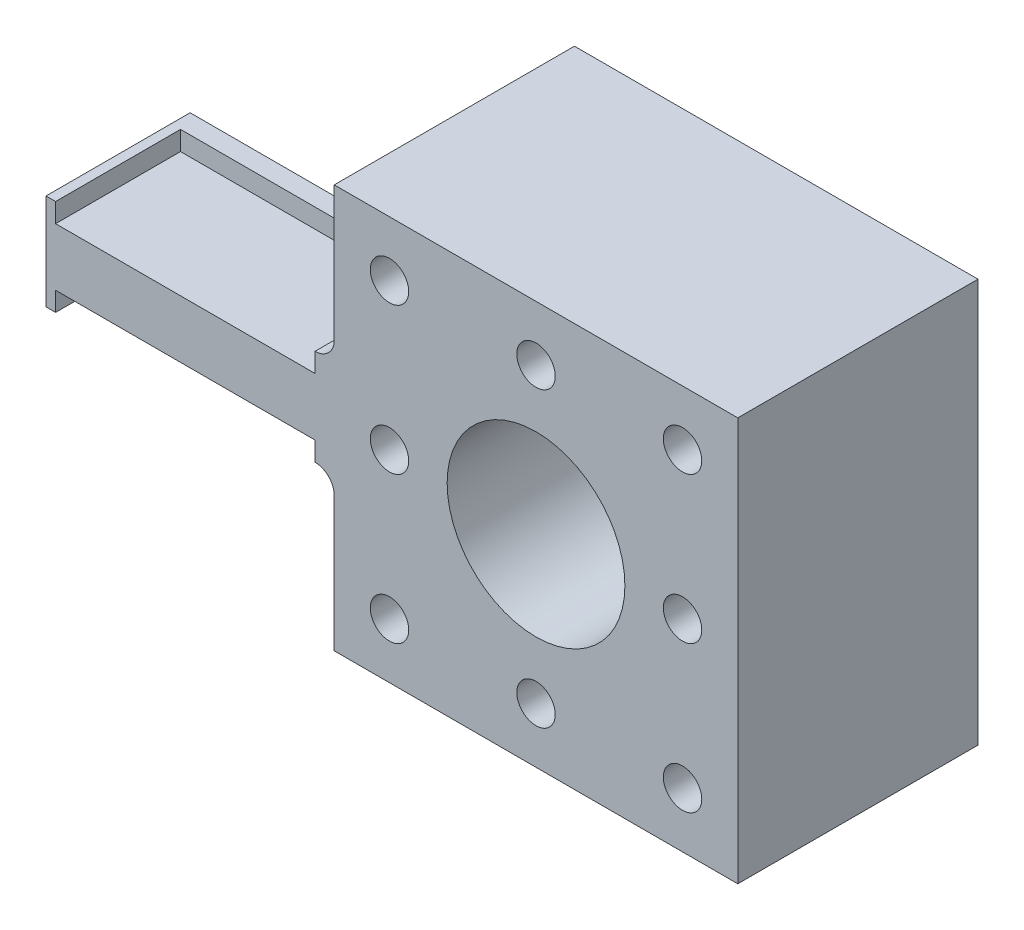
from build123d import *

# Parameters (mm, degrees)
SKETCH_1_W          = 42
SKETCH_1_H          = 42
EXTRUDE_1_DEPTH     = 25
SKETCH_2_R          = 9.25
CUT_EXTRUDE_1_DEPTH = 65.443773943
SKETCH_3_R          = 2
CUT_EXTRUDE_2_DEPTH = 3
EXTRUDE_2_DEPTH     = 30
SKETCH_5_W          = 27
SKETCH_5_H          = 13
CUT_EXTRUDE_3_DEPTH = 2
SKETCH_6_W          = 27
SKETCH_6_H          = 13
CUT_EXTRUDE_4_DEPTH = 2
FILLET_1_R          = 2


with BuildPart() as part:
    # 스케치1 → 보스-돌출1 (new body)
    with BuildSketch(Plane.XY):
        with Locations((21, -21)):
            Rectangle(SKETCH_1_W, SKETCH_1_H)
    extrude(amount=EXTRUDE_1_DEPTH)

    # 스케치2 → 컷-돌출1 (cut, through all)
    with BuildSketch(Plane.XY.offset(25)):
        with Locations((21, -21)):
            Circle(SKETCH_2_R)
    extrude(amount=-CUT_EXTRUDE_1_DEPTH, mode=Mode.SUBTRACT)

    # 스케치3 → 컷-돌출2 (cut)
    with BuildSketch(Plane.XY.offset(25)):
        with Locations((36.25, -36.25)):
            Circle(SKETCH_3_R)
        with Locations((5.75, -36.25)):
            Circle(SKETCH_3_R)
        with Locations((36.25, -5.75)):
            Circle(SKETCH_3_R)
        with Locations((5.75, -5.75)):
            Circle(SKETCH_3_R)
        with Locations((36.25, -21)):
            Circle(SKETCH_3_R)
        with Locations((21, -5.75)):
            Circle(SKETCH_3_R)
        with Locations((21, -36.25)):
            Circle(SKETCH_3_R)
        with Locations((5.75, -21)):
            Circle(SKETCH_3_R)
    extrude(amount=-CUT_EXTRUDE_2_DEPTH, mode=Mode.SUBTRACT)

    # 스케치4 → 보스-돌출2 (add)
    with BuildSketch(Plane.ZY):
        Polygon((25, -21), (25, -26), (10, -26), (10, -16), (25, -16), align=None)
    extrude(amount=EXTRUDE_2_DEPTH)

    # 스케치5 → 컷-돌출3 (cut)
    with BuildSketch(Plane(origin=(0, -26, 0), x_dir=(-1, 0, 0), z_dir=(0, -1, 0))):
        with Locations((15.5, -18.5)):
            Rectangle(SKETCH_5_W, SKETCH_5_H)
    extrude(amount=-CUT_EXTRUDE_3_DEPTH, mode=Mode.SUBTRACT)

    # 스케치6 → 컷-돌출4 (cut)
    with BuildSketch(Plane(origin=(0, -16, 0), x_dir=(1, 0, 0), z_dir=(0, 1, 0))):
        with Locations((-15.5, -18.5)):
            Rectangle(SKETCH_6_W, SKETCH_6_H)
    extrude(amount=-CUT_EXTRUDE_4_DEPTH, mode=Mode.SUBTRACT)

    # 필렛1
    fillet_1_edges = [part.edges().sort_by_distance(p)[0] for p in [
        (0, -16, 17.5),
        (0, -26, 17.5),
    ]]
    fillet(fillet_1_edges, radius=FILLET_1_R)


solid = part.part
